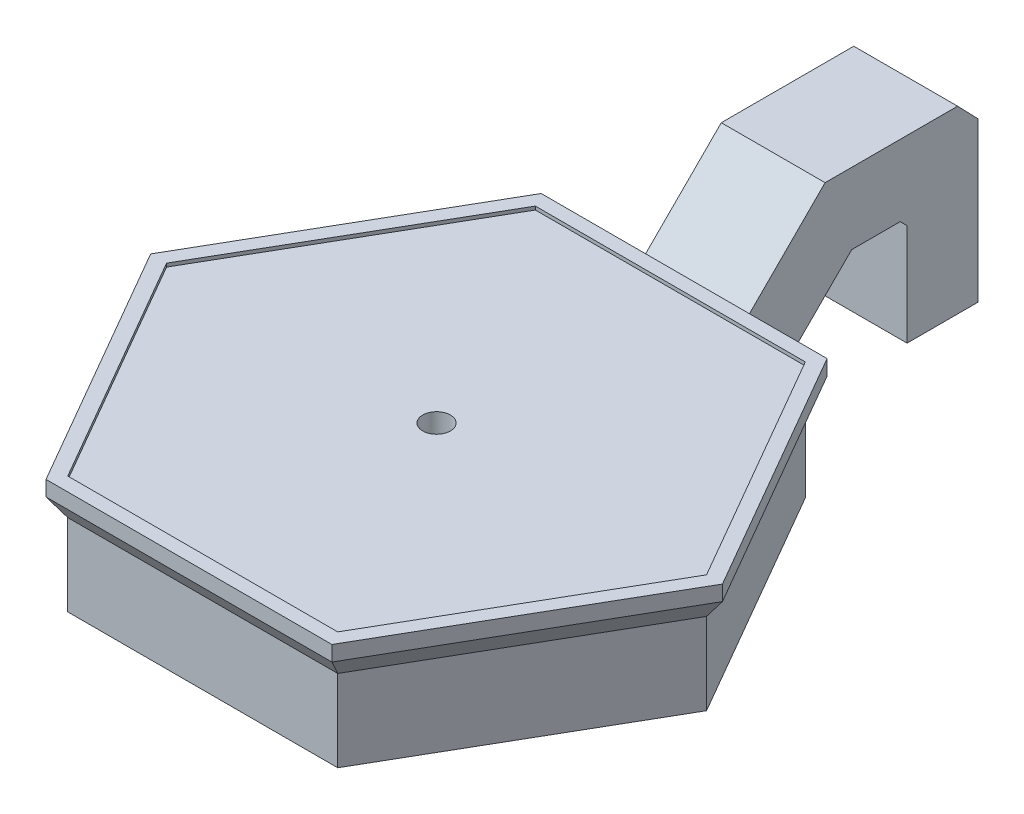
from build123d import *

# Parameters (mm, degrees)
SALIENTE_EXTRUIR1_DEPTH = 11.8
SALIENTE_EXTRUIR2_DEPTH = 2.2
CORTAR_EXTRUIR1_DEPTH   = 0.5
CROQUIS7_R              = 2
CORTAR_EXTRUIR2_DEPTH   = 58.071950338
SALIENTE_EXTRUIR3_DEPTH = 7.5


with BuildPart() as part:
    # Croquis1 → Saliente-Extruir1 (new body)
    with BuildSketch(Plane(origin=(0, 0, 0), x_dir=(1, 0, 0), z_dir=(0, 1, 0))):
        Polygon((19.5, -33.774990748), (39, 0), (19.5, 33.774990748), (-19.5, 33.774990748), (-39, 0), (-19.5, -33.774990748), align=None)
    extrude(amount=SALIENTE_EXTRUIR1_DEPTH)

    # Croquis4 → section 1 of recubrir2
    with BuildSketch(Plane(origin=(0, 14.8, 0), x_dir=(1, 0, 0), z_dir=(0, 1, 0)), mode=Mode.PRIVATE) as recubrir2_s1:
        with BuildLine():
            Line((20.65, -35.766849176), (41.3, 0))
            Line((41.3, 0), (20.65, 35.766849176))
            Line((20.65, 35.766849176), (-20.65, 35.766849176))
            Line((-20.65, 35.766849176), (-41.3, 0))
            Line((-41.3, 0), (-20.65, -35.766849176))
            Line((-20.65, -35.766849176), (20.65, -35.766849176))
        make_face()
    # loft from a face of the part (recubrir2)
    loft([part.faces().sort_by_distance((0, 11.8, 0))[0], recubrir2_s1.sketch])

    # Croquis5 → Saliente-Extruir2 (add)
    with BuildSketch(Plane(origin=(0, 14.8, 0), x_dir=(1, 0, 0), z_dir=(0, 1, 0))):
        Polygon((20.65, -35.766849176), (41.3, 0), (20.65, 35.766849176), (-20.65, 35.766849176), (-41.3, 0), (-20.65, -35.766849176), align=None)
    extrude(amount=SALIENTE_EXTRUIR2_DEPTH)

    # Croquis6 → Cortar-Extruir1 (cut)
    with BuildSketch(Plane(origin=(0, 17, 0), x_dir=(1, 0, 0), z_dir=(0, 1, 0))):
        Polygon((19.5, -33.774990748), (39, 0), (19.5, 33.774990748), (-19.5, 33.774990748), (-39, 0), (-19.5, -33.774990748), align=None)
    extrude(amount=-CORTAR_EXTRUIR1_DEPTH, mode=Mode.SUBTRACT)

    # Croquis7 → Cortar-Extruir2 (cut, through all)
    with BuildSketch(Plane(origin=(0, 16.5, 0), x_dir=(1, 0, 0), z_dir=(0, 1, 0))):
        with Locations(Location((0, 0, 0), (0, 0, 270))):
            Circle(CROQUIS7_R)
    extrude(amount=-CORTAR_EXTRUIR2_DEPTH, mode=Mode.SUBTRACT)

    # Croquis8 → Saliente-Extruir3 (add, symmetric)
    with BuildSketch(Plane(origin=(0, 0, 0), x_dir=(0, 0, -1), z_dir=(1, 0, 0))):
        Polygon((36.774990748, 0), (52.47276129, 15.697770542), (59.47276129, 15.697770542), (60.469781851, 14.700749981), (60.469781851, 0), (70.716946405, 0), (70.716946405, 22.948703413), (67.771594914, 25.998704166), (48.631594914, 25.998704166), (34.432890748, 11.8), (33.774990748, 11.8), (33.774990748, 0), align=None)
    extrude(amount=SALIENTE_EXTRUIR3_DEPTH, both=True)


solid = part.part
